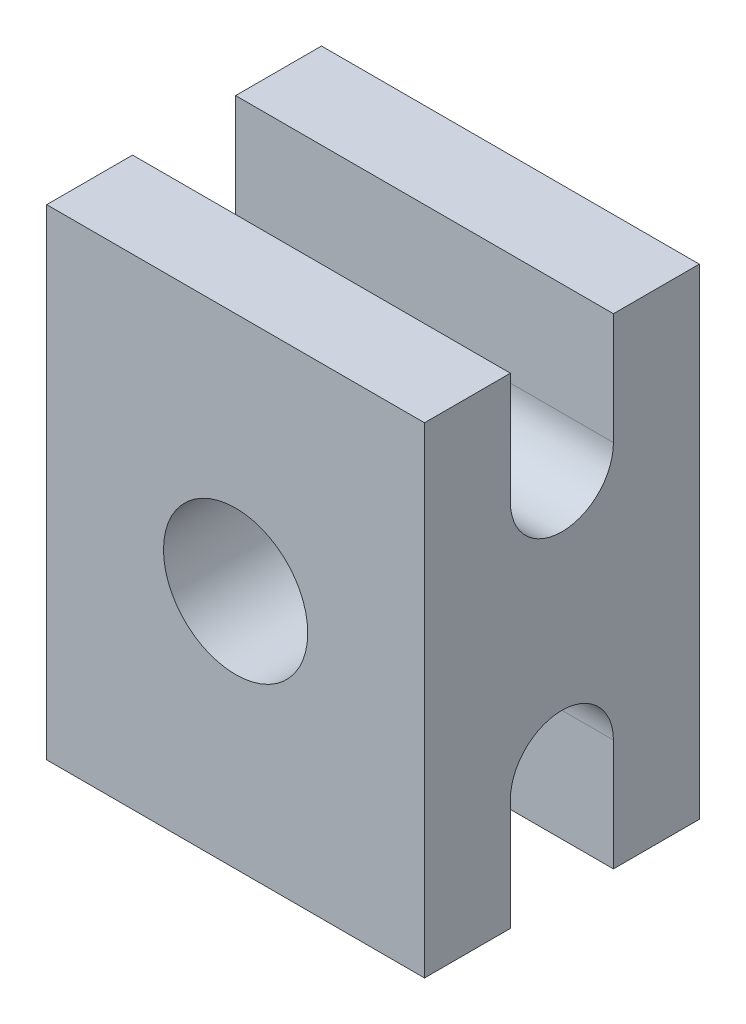
from build123d import *

# Parameters (mm, degrees)
SKETCH_1_W          = 11
SKETCH_1_H          = 14
SKETCH_1_R          = 2.1
EXTRUDE_1_DEPTH     = 8
CUT_EXTRUDE_1_DEPTH = 18


with BuildPart() as part:
    # Эскиз1 → Вытянуть1 (new body)
    with BuildSketch(Plane.XY):
        with Locations((5.5, 7)):
            Rectangle(SKETCH_1_W, SKETCH_1_H)
        with Locations((5.5, 7)):
            Circle(SKETCH_1_R, mode=Mode.SUBTRACT)
    extrude(amount=EXTRUDE_1_DEPTH)

    # Эскиз2 → Вырез-Вытянуть1 (cut)
    with BuildSketch(Plane(origin=(11, 0, 0), x_dir=(0, 0, -1), z_dir=(1, 0, 0))):
        with BuildLine():
            Line((-5.5, 15.242713302), (-2.5, 15.242713302))
            Line((-2.5, 15.242713302), (-2.5, 10.75))
            ThreePointArc((-2.5, 10.75), (-4.00000012, 9.25), (-5.5, 10.750000239))
            Line((-5.5, 10.750000239), (-5.5, 15.242713302))
        make_face()
        with BuildLine():
            Line((-5.5, -1.965553789), (-2.5, -1.965553789))
            Line((-2.5, -1.965553789), (-2.5, 3.25))
            ThreePointArc((-2.5, 3.25), (-3.999999879, 4.75), (-5.5, 3.250000241))
            Line((-5.5, 3.250000241), (-5.5, -1.965553789))
        make_face()
    extrude(amount=-CUT_EXTRUDE_1_DEPTH, mode=Mode.SUBTRACT)


solid = part.part
